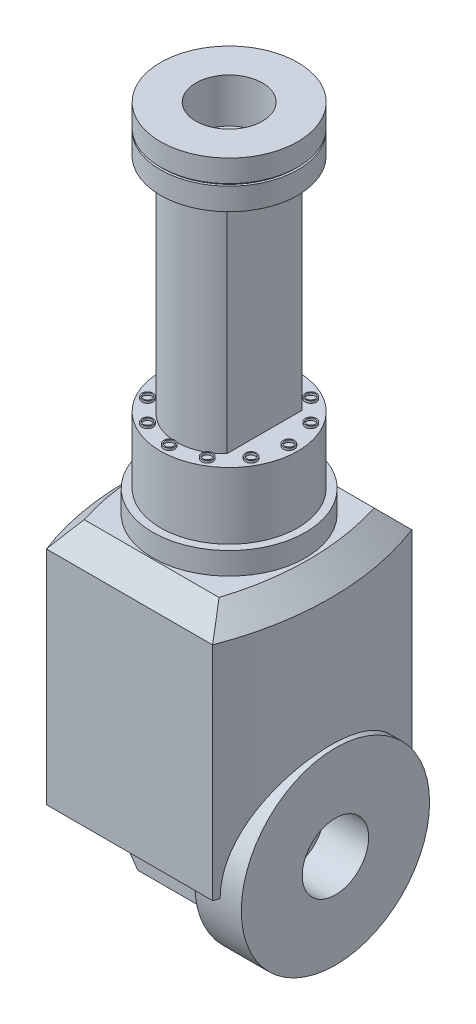
from build123d import *

# Parameters (mm, degrees)
BOSS_EXTRUDE1_DEPTH  = 100
BOSS_EXTRUDE2_DEPTH  = 10
BOSS_EXTRUDE2_DRAFT  = 45
SKETCH3_R            = 34.5
BOSS_EXTRUDE3_DEPTH  = 10
SKETCH4_R            = 31
BOSS_EXTRUDE4_DEPTH  = 30
SKETCH5_R            = 2.5
SKETCH5_R_2          = 2
BOSS_EXTRUDE5_DEPTH  = 1
CIRPATTERN1_COUNT    = 12
BOSS_EXTRUDE6_DEPTH  = 100
SKETCH7_R            = 31
BOSS_EXTRUDE7_DEPTH  = 10
SKETCH8_R            = 30
BOSS_EXTRUDE8_DEPTH  = 1
SKETCH9_R            = 31
BOSS_EXTRUDE9_DEPTH  = 10
SKETCH11_R           = 42.5
BOSS_EXTRUDE10_DEPTH = 10.5
BOSS_EXTRUDE11_DEPTH = 35
BOSS_EXTRUDE12_DEPTH = 40
CUT_EXTRUDE1_DEPTH   = 40
SKETCH16_R           = 15
CUT_EXTRUDE2_DEPTH   = 20
SKETCH17_R           = 15
CUT_EXTRUDE3_DEPTH   = 20


with BuildPart() as part:
    # Sketch1 → Boss-Extrude1 (new body)
    with BuildSketch(Plane(origin=(0, 0, 0), x_dir=(1, 0, 0), z_dir=(0, 1, 0))):
        with BuildLine():
            Line((-37.5, 45), (37.5, 45))
            ThreePointArc((37.5, 45), (45.880962103, 0), (37.5, -45))
            Line((37.5, -45), (-37.5, -45))
            ThreePointArc((-37.5, -45), (-45.880962103, 0), (-37.5, 45))
        make_face()
    extrude(amount=BOSS_EXTRUDE1_DEPTH)


with BuildPart() as boss_extrude2_tool:
    # Sketch2 → Boss-Extrude2 (with draft: the straight prism first)
    with BuildSketch(Plane(origin=(0, 100, 0), x_dir=(1, 0, 0), z_dir=(0, 1, 0))):
        with BuildLine():
            Line((37.5, 45), (-37.5, 45))
            ThreePointArc((-37.5, 45), (-45.880962103, 0), (-37.5, -45))
            Line((-37.5, -45), (37.5, -45))
            ThreePointArc((37.5, -45), (45.880962103, 0), (37.5, 45))
        make_face()
    extrude(amount=BOSS_EXTRUDE2_DEPTH)
    # Boss-Extrude2: the draft: its side faces are tilted about the plane it starts from
    boss_extrude2_sides = [boss_extrude2_tool.faces().sort_by_distance(p)[0] for p in [
        (0, 105, -45),
        (-45.880962103, 105, 0),
        (0, 105, 45),
        (45.880962103, 105, 0),
    ]]
    draft(boss_extrude2_sides, Plane(origin=(0, 100, 0), x_dir=(1, 0, 0), z_dir=(0, 1, 0)), BOSS_EXTRUDE2_DRAFT)


with BuildPart() as part_1:
    add(part.part)

    # Boss-Extrude2: add boss_extrude2_tool
    add(boss_extrude2_tool.part)

    # Sketch3 → Boss-Extrude3 (add)
    with BuildSketch(Plane(origin=(0, 110, 0), x_dir=(1, 0, 0), z_dir=(0, 1, 0))):
        with Locations(Location((0, 0, 0), (0, 0, 270))):
            Circle(SKETCH3_R)
    extrude(amount=BOSS_EXTRUDE3_DEPTH)

    # Sketch4 → Boss-Extrude4 (add)
    with BuildSketch(Plane(origin=(0, 120, 0), x_dir=(1, 0, 0), z_dir=(0, 1, 0))):
        with Locations(Location((0, 0, 0), (0, 0, 270))):
            Circle(SKETCH4_R)
    extrude(amount=BOSS_EXTRUDE4_DEPTH)

    # Sketch5 → Boss-Extrude5 (add)
    with BuildSketch(Plane(origin=(0, 150, 0), x_dir=(1, 0, 0), z_dir=(0, 1, 0))):
        with Locations(Location((27, 0, 0), (0, 0, 270))):
            Circle(SKETCH5_R)
        with Locations(Location((27, 0, 0), (0, 0, 270))):
            Circle(SKETCH5_R_2, mode=Mode.SUBTRACT)
    boss_extrude5 = extrude(amount=BOSS_EXTRUDE5_DEPTH)

    # CirPattern1: Boss-Extrude5 ×12 about axis
    cirpattern1_axis = Axis((0, 0, 0), (0, 1, 0))
    for i in range(1, CIRPATTERN1_COUNT):
        add(boss_extrude5.rotate(cirpattern1_axis, i * 360 / CIRPATTERN1_COUNT))

    # Sketch6 → Boss-Extrude6 (add)
    with BuildSketch(Plane(origin=(0, 150, 0), x_dir=(1, 0, 0), z_dir=(0, 1, 0))):
        with BuildLine():
            Line((16, 17), (16, -17))
            ThreePointArc((16, -17), (0, -23.900331129), (-16, -17))
            Line((-16, -17), (-16, 17))
            ThreePointArc((-16, 17), (0, 23.900331129), (16, 17))
        make_face()
    extrude(amount=BOSS_EXTRUDE6_DEPTH)

    # Sketch7 → Boss-Extrude7 (add)
    with BuildSketch(Plane(origin=(0, 250, 0), x_dir=(1, 0, 0), z_dir=(0, 1, 0))):
        with Locations(Location((0, 0, 0), (0, 0, 270))):
            Circle(SKETCH7_R)
    extrude(amount=BOSS_EXTRUDE7_DEPTH)

    # Sketch8 → Boss-Extrude8 (add)
    with BuildSketch(Plane(origin=(0, 260, 0), x_dir=(1, 0, 0), z_dir=(0, 1, 0))):
        with Locations(Location((0, 0, 0), (0, 0, 270))):
            Circle(SKETCH8_R)
    extrude(amount=BOSS_EXTRUDE8_DEPTH)

    # Sketch9 → Boss-Extrude9 (add)
    with BuildSketch(Plane(origin=(0, 261, 0), x_dir=(1, 0, 0), z_dir=(0, 1, 0))):
        with Locations(Location((0, 0, 0), (0, 0, 270))):
            Circle(SKETCH9_R)
    extrude(amount=BOSS_EXTRUDE9_DEPTH)

    # Sketch11 → Boss-Extrude10 (add, symmetric)
    with BuildSketch(Plane.ZY.offset(-37.5)):
        Circle(SKETCH11_R)
    extrude(amount=BOSS_EXTRUDE10_DEPTH, both=True)

    # Sketch12 → Boss-Extrude11 (add)
    with BuildSketch(Plane.ZY.offset(-27)):
        with BuildLine():
            Line((-20, 0), (20, 0))
            Line((20, 0), (20, -30))
            ThreePointArc((20, -30), (0, -37.639320225), (-20, -30))
            Line((-20, -30), (-20, 0))
        make_face()
    extrude(amount=BOSS_EXTRUDE11_DEPTH)

    # Sketch14 → Boss-Extrude12 (add)
    with BuildSketch(Plane(origin=(0, 0, -20), x_dir=(-1, 0, 0), z_dir=(0, 0, -1))):
        with BuildLine():
            Line((8, 0), (8, -42))
            ThreePointArc((8, -42), (25.421855105, -23.929675658), (33, 0))
            Line((33, 0), (8, 0))
        make_face()
    extrude(amount=-BOSS_EXTRUDE12_DEPTH)

    # Sketch15 → Cut-Extrude1 (cut)
    with BuildSketch(Plane(origin=(-8, 0, 0), x_dir=(0, 0, -1), z_dir=(1, 0, 0))):
        with BuildLine():
            Line((-20, -30), (-20, -42))
            Line((-20, -42), (20, -42))
            Line((20, -42), (20, -30))
            ThreePointArc((20, -30), (0, -37.639320225), (-20, -30))
        make_face()
    extrude(amount=-CUT_EXTRUDE1_DEPTH, mode=Mode.SUBTRACT)

    # Sketch16 → Cut-Extrude2 (cut)
    with BuildSketch(Plane(origin=(0, 271, 0), x_dir=(1, 0, 0), z_dir=(0, 1, 0))):
        with Locations(Location((0, 0, 0), (0, 0, 270))):
            Circle(SKETCH16_R)
    extrude(amount=-CUT_EXTRUDE2_DEPTH, mode=Mode.SUBTRACT)

    # Sketch17 → Cut-Extrude3 (cut)
    with BuildSketch(Plane(origin=(48, 0, 0), x_dir=(0, 0, -1), z_dir=(1, 0, 0))):
        Circle(SKETCH17_R)
    extrude(amount=-CUT_EXTRUDE3_DEPTH, mode=Mode.SUBTRACT)


solid = part_1.part
